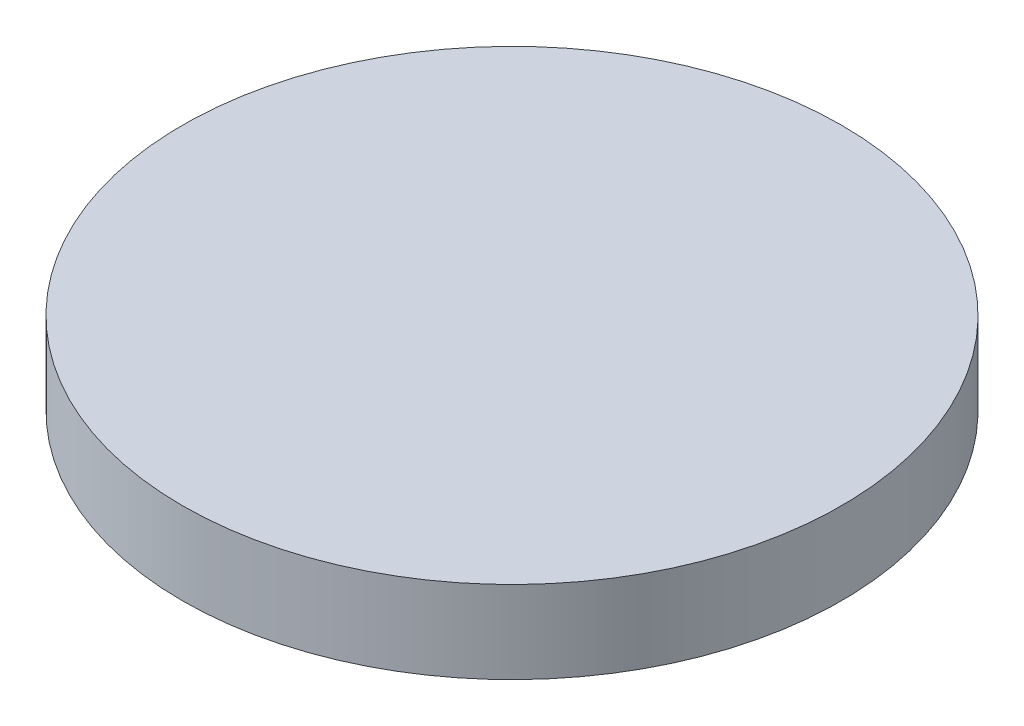
from build123d import *

# Parameters (mm, degrees)
SKETCH1_R      = 38.1
EXTRUDE1_DEPTH = 9.525


with BuildPart() as part:
    # Sketch1 → Extrude1 (new body)
    with BuildSketch(Plane(origin=(0, 0, 0), x_dir=(1, 0, 0), z_dir=(0, 1, 0))):
        with Locations(Location((0, 0, 0), (0, 0, 90))):
            Circle(SKETCH1_R)
    extrude(amount=EXTRUDE1_DEPTH)


solid = part.part
